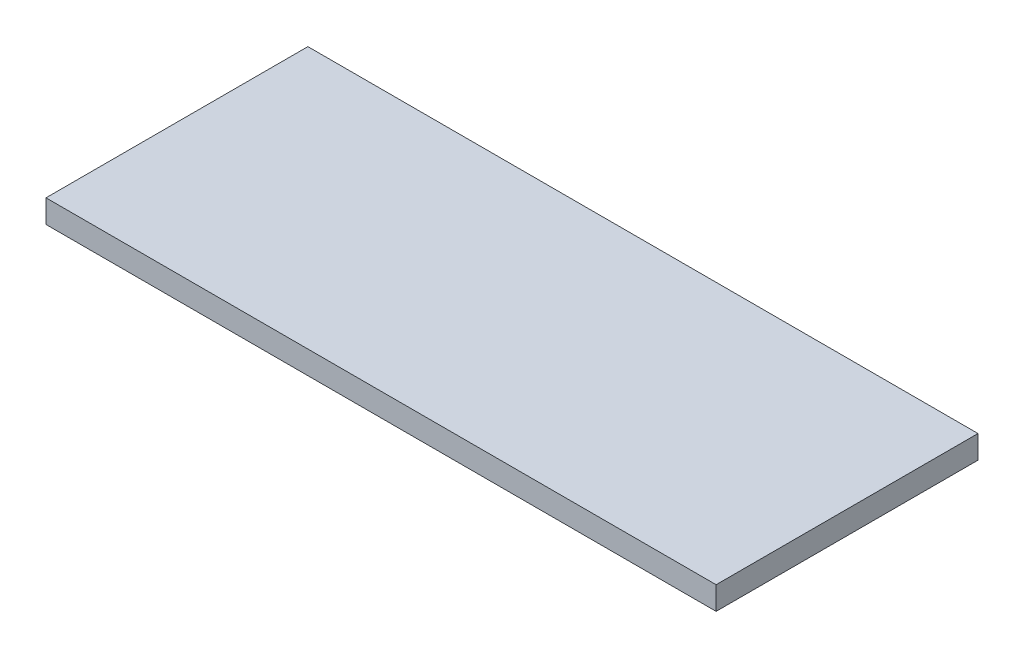
from build123d import *

# Parameters (mm, degrees)
SKETCH1_W           = 552.45
SKETCH1_H           = 215.9
BOSS_EXTRUDE1_DEPTH = 19.05


with BuildPart() as part:
    # Sketch1 → Boss-Extrude1 (new body)
    with BuildSketch(Plane(origin=(0, 0, 0), x_dir=(1, 0, 0), z_dir=(0, 1, 0))):
        with Locations((276.225, 107.95)):
            Rectangle(SKETCH1_W, SKETCH1_H)
    extrude(amount=BOSS_EXTRUDE1_DEPTH)


solid = part.part
